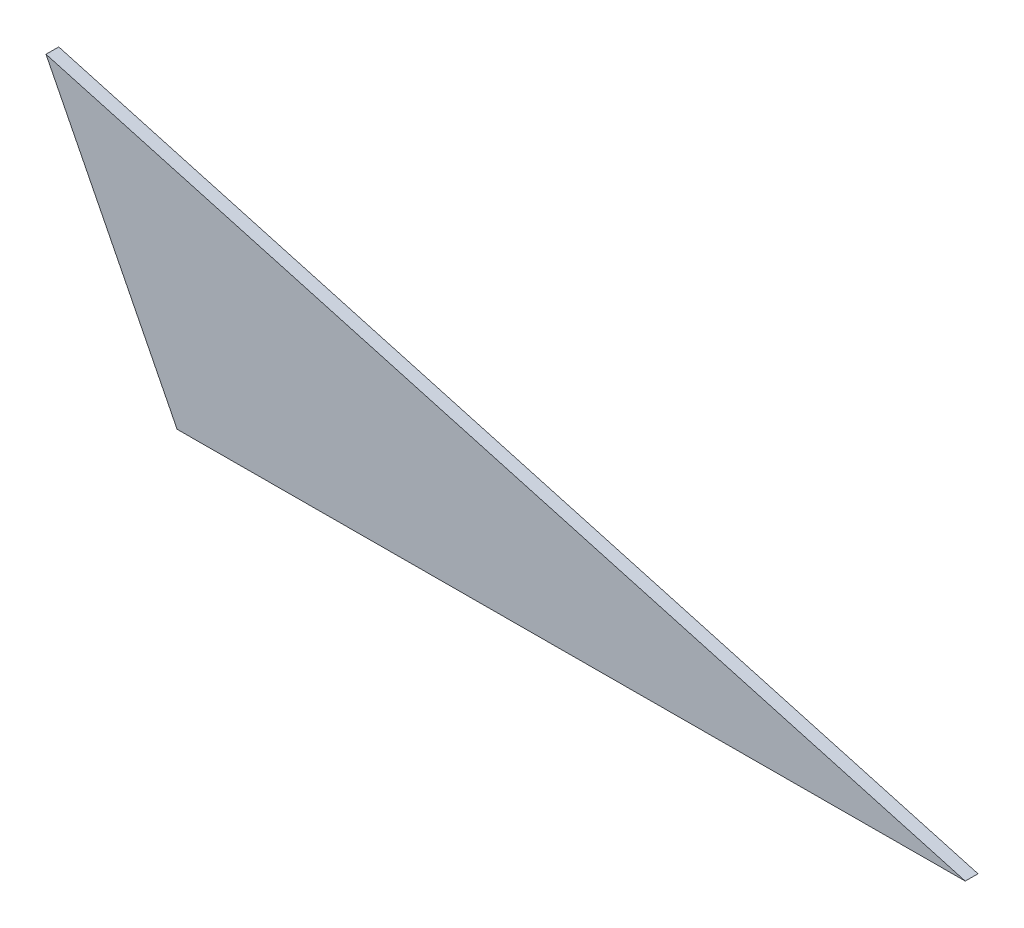
from build123d import *

# Parameters (mm, degrees)
BOSS_EXTRUDE1_DEPTH = 15


with BuildPart() as part:
    # Sketch1 → Boss-Extrude1 (new body)
    with BuildSketch(Plane.XY):
        Polygon((-435.181198885, 102.547061821), (648.852942116, -199.84140909), (-280.574961477, -203.154627929), align=None)
    extrude(amount=BOSS_EXTRUDE1_DEPTH)


solid = part.part
